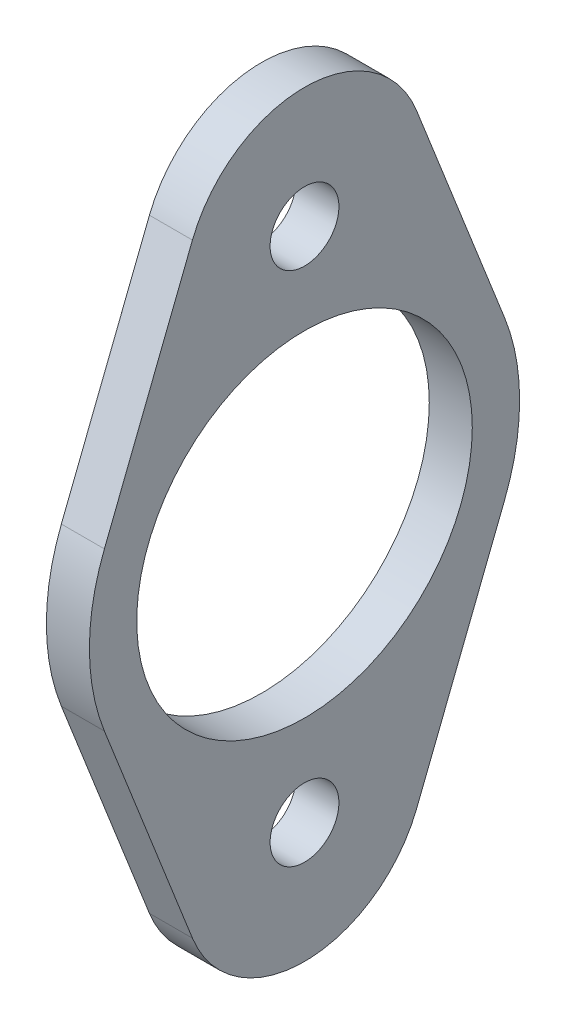
from build123d import *

# Parameters (mm, degrees)
SKETCH1_R           = 19.5
SKETCH1_R_2         = 4
BOSS_EXTRUDE1_DEPTH = 2.5


with BuildPart() as part:
    # Sketch1 → Boss-Extrude1 (new, symmetric)
    with BuildSketch(Plane.YZ):
        with BuildLine():
            Line((-35.133333333, 13.024933354), (-9.166666667, 23.258809562))
            ThreePointArc((-9.166666667, 23.258809562), (0, 25), (9.166666667, 23.258809562))
            Line((9.166666667, 23.258809562), (35.133333333, 13.024933354))
            ThreePointArc((35.133333333, 13.024933354), (44, 0), (35.133333333, -13.024933354))
            Line((35.133333333, -13.024933354), (9.166666667, -23.258809562))
            ThreePointArc((9.166666667, -23.258809562), (0, -25), (-9.166666667, -23.258809562))
            Line((-9.166666667, -23.258809562), (-35.133333333, -13.024933354))
            ThreePointArc((-35.133333333, -13.024933354), (-44, 0), (-35.133333333, 13.024933354))
        make_face()
        with Locations(Location((0, 0, 0), (0, 0, 270))):
            Circle(SKETCH1_R, mode=Mode.SUBTRACT)
        with Locations(Location((30, 0, 0), (0, 0, 270))):
            Circle(SKETCH1_R_2, mode=Mode.SUBTRACT)
        with Locations(Location((-30, 0, 0), (0, 0, 270))):
            Circle(SKETCH1_R_2, mode=Mode.SUBTRACT)
    extrude(amount=BOSS_EXTRUDE1_DEPTH, both=True)


solid = part.part
